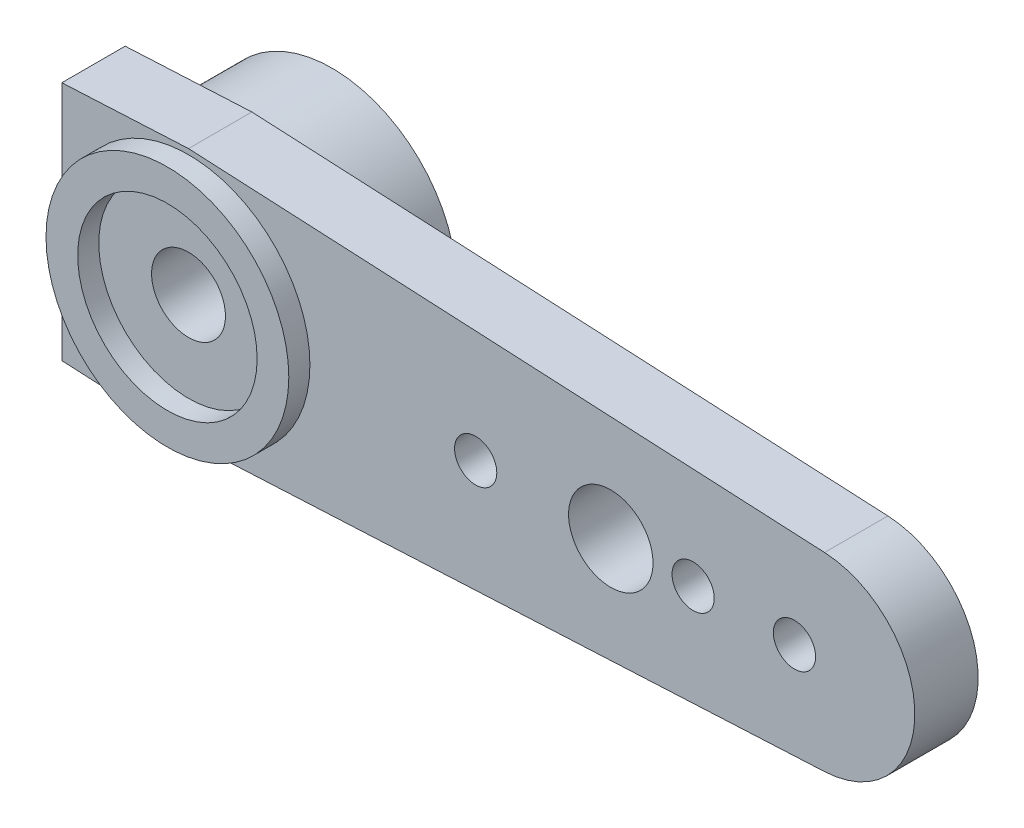
from build123d import *

# Parameters (mm, degrees)
SKETCH1_R           = 2.95
SKETCH1_R_2         = 2.25
BOSS_EXTRUDE1_DEPTH = 1.9
SKETCH2_R           = 0.875
SKETCH2_R_2         = 0.5
BOSS_EXTRUDE2_DEPTH = 1.5
SKETCH3_R           = 2.875
SKETCH3_R_2         = 2.125
BOSS_EXTRUDE3_DEPTH = 0.5
SKETCH4_R           = 1
CUT_EXTRUDE1_DEPTH  = 18.787636155
CUT_EXTRUDE2_DEPTH  = 18.787636155


with BuildPart() as part:
    # Sketch1 → Boss-Extrude1 (new body)
    with BuildSketch(Plane.XY):
        with Locations(Location((0, 0, 0), (0, 0, 180))):
            Circle(SKETCH1_R)
        with Locations(Location((0, 0, 0), (0, 0, 180))):
            Circle(SKETCH1_R_2, mode=Mode.SUBTRACT)
    extrude(amount=BOSS_EXTRUDE1_DEPTH)

    # Sketch2 → Boss-Extrude2 (add)
    with BuildSketch(Plane.XY.offset(1.9)):
        with BuildLine():
            Line((15.062313393, 2.247195074), (0, 3))
            Line((0, 3), (-15.062313393, 2.247195074))
            ThreePointArc((-15.062313393, 2.247195074), (-17.2, 0), (-15.062313393, -2.247195074))
            Line((-15.062313393, -2.247195074), (0, -3))
            Line((0, -3), (15.062313393, -2.247195074))
            ThreePointArc((15.062313393, -2.247195074), (17.2, 0), (15.062313393, 2.247195074))
        make_face()
        Circle(SKETCH2_R, mode=Mode.SUBTRACT)
        with Locations((6.8, 0)):
            Circle(SKETCH2_R_2, mode=Mode.SUBTRACT)
        with Locations((9.55, 0)):
            Circle(SKETCH2_R_2, mode=Mode.SUBTRACT)
        with Locations((11.95, 0)):
            Circle(SKETCH2_R_2, mode=Mode.SUBTRACT)
        with Locations((14.35, 0)):
            Circle(SKETCH2_R_2, mode=Mode.SUBTRACT)
        with Locations(Location((-14.35, 0, 0), (0, 0, 180))):
            Circle(SKETCH2_R_2, mode=Mode.SUBTRACT)
        with Locations(Location((-11.95, 0, 0), (0, 0, 180))):
            Circle(SKETCH2_R_2, mode=Mode.SUBTRACT)
        with Locations(Location((-9.55, 0, 0), (0, 0, 180))):
            Circle(SKETCH2_R_2, mode=Mode.SUBTRACT)
        with Locations(Location((-6.8, 0, 0), (0, 0, 180))):
            Circle(SKETCH2_R_2, mode=Mode.SUBTRACT)
    extrude(amount=BOSS_EXTRUDE2_DEPTH)

    # Sketch3 → Boss-Extrude3 (add)
    with BuildSketch(Plane.XY.offset(3.4)):
        Circle(SKETCH3_R)
        Circle(SKETCH3_R_2, mode=Mode.SUBTRACT)
    extrude(amount=BOSS_EXTRUDE3_DEPTH)

    # Sketch4 → Cut-Extrude1 (cut, through all)
    with BuildSketch(Plane.XY.offset(3.4)):
        with Locations((10, 0)):
            Circle(SKETCH4_R)
    extrude(amount=-CUT_EXTRUDE1_DEPTH, mode=Mode.SUBTRACT)

    # Sketch5 → Cut-Extrude2 (cut, through all)
    with BuildSketch(Plane.XY.offset(3.4)):
        with BuildLine():
            Line((-3, 2.850061892), (-3, -2.850061892))
            Line((-3, -2.850061892), (-15.062313393, -2.247195074))
            ThreePointArc((-15.062313393, -2.247195074), (-17.2, 0), (-15.062313393, 2.247195074))
            Line((-15.062313393, 2.247195074), (-3, 2.850061892))
        make_face()
    extrude(amount=-CUT_EXTRUDE2_DEPTH, mode=Mode.SUBTRACT)


solid = part.part
